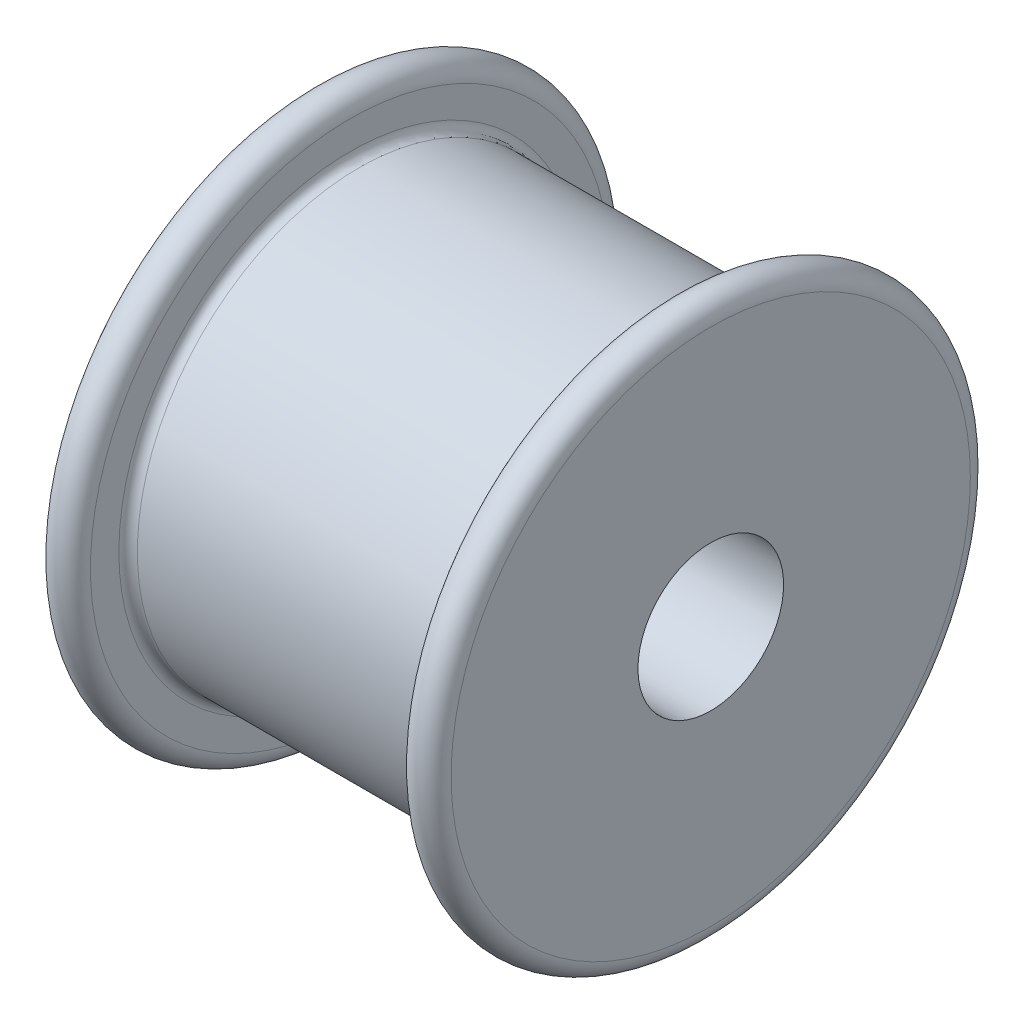
from build123d import *

# Parameters (mm, degrees)
SKETCH2_R           = 50
CUT_EXTRUDE1_DEPTH  = 385.031388791
SKETCH3_R           = 140
CUT_EXTRUDE3_DEPTH  = 215
BOSS_EXTRUDE1_START = 115
SKETCH5_R           = 64.559730184
SKETCH5_R_2         = 50
BOSS_EXTRUDE1_DEPTH = 115


with BuildPart() as part:
    # Sketch1 → Revolve1 (revolve)
    with BuildSketch(Plane.XY):
        with BuildLine():
            Line((104.775, 152.4), (-104.775, 152.4))
            ThreePointArc((-104.775, 152.4), (-109.265128061, 154.259871939), (-111.125, 158.75))
            Line((-111.125, 158.75), (-111.125, 178.25))
            ThreePointArc((-111.125, 178.25), (-123.825, 190.95), (-136.525, 178.25))
            Line((-136.525, 178.25), (-136.525, 0))
            Line((-136.525, 0), (136.525, 0))
            Line((136.525, 0), (136.525, 178.25))
            ThreePointArc((136.525, 178.25), (123.825, 190.95), (111.125, 178.25))
            Line((111.125, 178.25), (111.125, 158.75))
            ThreePointArc((111.125, 158.75), (109.265128061, 154.259871939), (104.775, 152.4))
        make_face()
    revolve(axis=Axis((0, 0, 0), (-1, 0, 0)))

    # Sketch2 → Cut-Extrude1 (cut, through all)
    with BuildSketch(Plane.ZY.offset(136.525)):
        Circle(SKETCH2_R)
    extrude(amount=-CUT_EXTRUDE1_DEPTH, mode=Mode.SUBTRACT)

    # Sketch3 → Cut-Extrude3 (cut)
    with BuildSketch(Plane.ZY.offset(136.525)):
        Circle(SKETCH3_R)
    extrude(amount=-CUT_EXTRUDE3_DEPTH, mode=Mode.SUBTRACT)

    # Sketch5 → Boss-Extrude1 (add)
    with BuildSketch(Plane.ZY.offset(-78.475).offset(BOSS_EXTRUDE1_START)):
        Circle(SKETCH5_R)
        Circle(SKETCH5_R_2, mode=Mode.SUBTRACT)
    extrude(amount=-BOSS_EXTRUDE1_DEPTH)


solid = part.part
